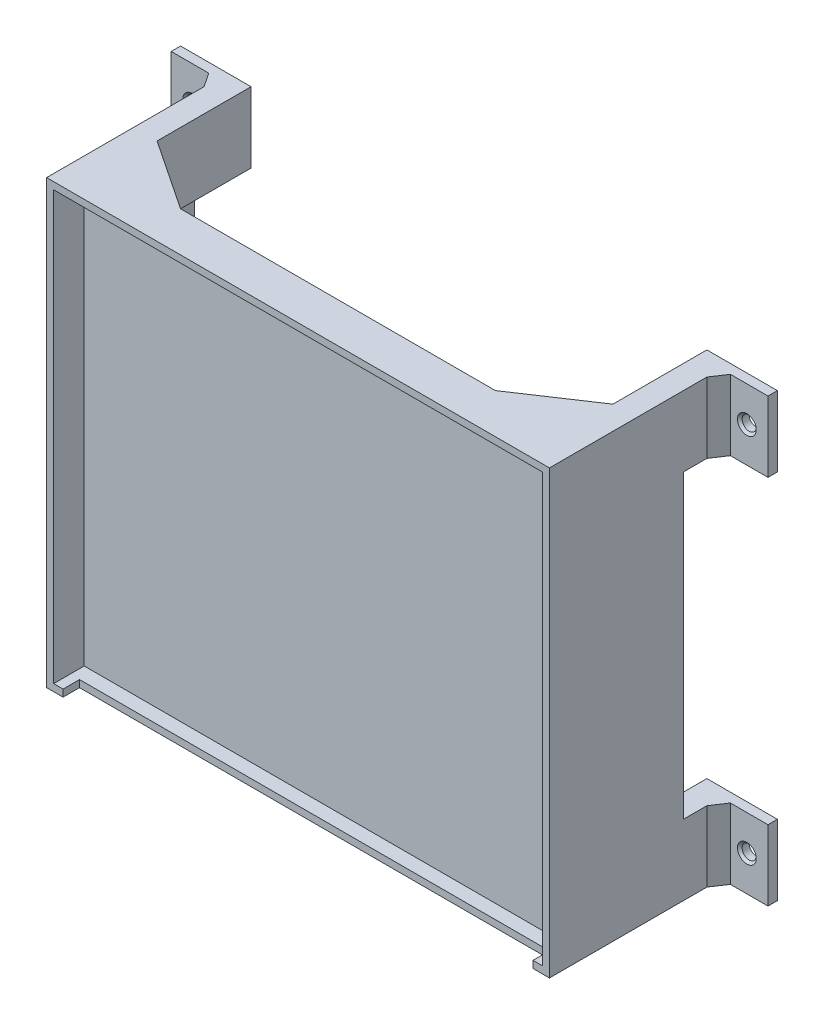
from build123d import *

# Parameters (mm, degrees)
SKETCH_1_W               = 107
SKETCH_1_H               = 94
EXTRUDE_1_DEPTH          = 2
SKETCH_2_W               = 107
SKETCH_2_H               = 94
SKETCH_2_W_2             = 104
SKETCH_2_H_2             = 91
EXTRUDE_2_DEPTH          = 6.5
SKETCH_5_W               = 100
SKETCH_5_H               = 3.5
CUT_EXTRUDE_2_DEPTH      = 1.5
SKETCH_3_W               = 5
SKETCH_3_H               = 15
EXTRUDE_3_DEPTH          = 30
CUT_EXTRUDE_3_DEPTH      = 148.537283424
CUT_EXTRUDE_3_DEPTH_BACK = 30
SKETCH_6_W               = 3
SKETCH_6_H               = 9
SKETCH_7_W               = 10
SKETCH_7_H               = 15
EXTRUDE_4_DEPTH          = 2
SKETCH_8_R               = 1.5
CUT_EXTRUDE_4_DEPTH      = 2
CHAMFER_1_SIZE           = 0.5
EXTRUDE_5_DEPTH          = 3
EXTRUDE_6_DEPTH          = 3
EXTRUDE_7_DEPTH          = 3
MIRROR_2_COPY_1_DEPTH    = 3
EXTRUDE_8_DEPTH          = 15
EXTRUDE_9_DEPTH          = 15
EXTRUDE_10_DEPTH         = 9
EXTRUDE_11_DEPTH         = 9
EXTRUDE_12_DEPTH         = 3


with BuildPart() as part:
    # 草图1 → 凸台-拉伸1 (new body)
    with BuildSketch(Plane.XY):
        with Locations((53.5, -47)):
            Rectangle(SKETCH_1_W, SKETCH_1_H)
    extrude(amount=EXTRUDE_1_DEPTH)

    # 草图2 → 凸台-拉伸2 (add)
    with BuildSketch(Plane.XY.offset(2)):
        with Locations((53.5, -47)):
            Rectangle(SKETCH_2_W, SKETCH_2_H)
        with Locations((53.5, -47)):
            Rectangle(SKETCH_2_W_2, SKETCH_2_H_2, mode=Mode.SUBTRACT)
    extrude(amount=EXTRUDE_2_DEPTH)

    # 草图5 → 切除-拉伸2 (cut)
    with BuildSketch(Plane(origin=(0, -92.5, 0), x_dir=(1, 0, 0), z_dir=(0, 1, 0))):
        with Locations((53.5, -6.75)):
            Rectangle(SKETCH_5_W, SKETCH_5_H)
    extrude(amount=-CUT_EXTRUDE_2_DEPTH, mode=Mode.SUBTRACT)

    # 草图3 → 凸台-拉伸3 (add)
    with BuildSketch(Plane(origin=(0, 0, 0), x_dir=(-1, 0, 0), z_dir=(0, 0, -1))):
        with Locations((-2.5, -7.5)):
            Rectangle(SKETCH_3_W, SKETCH_3_H)
        with Locations((-104.5, -7.5)):
            Rectangle(SKETCH_3_W, SKETCH_3_H)
        with Locations((-2.5, -86.5)):
            Rectangle(SKETCH_3_W, SKETCH_3_H)
        with Locations((-104.5, -86.5)):
            Rectangle(SKETCH_3_W, SKETCH_3_H)
    extrude(amount=EXTRUDE_3_DEPTH)

    # 草图6 → 切除-拉伸3 (cut, two sides: drawn at the far end of the back side and taken through both)
    with BuildSketch(Plane(origin=(0, 0, -30), x_dir=(-1, 0, 0), z_dir=(0, 0, -1)).offset(-CUT_EXTRUDE_3_DEPTH_BACK)):
        with Locations((-103.5, -7.5)):
            Rectangle(SKETCH_6_W, SKETCH_6_H)
        with Locations((-103.5, -86.5)):
            Rectangle(SKETCH_6_W, SKETCH_6_H)
        with Locations((-3.5, -86.5)):
            Rectangle(SKETCH_6_W, SKETCH_6_H)
        with Locations((-3.5, -7.5)):
            Rectangle(SKETCH_6_W, SKETCH_6_H)
    extrude(amount=CUT_EXTRUDE_3_DEPTH + CUT_EXTRUDE_3_DEPTH_BACK, mode=Mode.SUBTRACT)

    # 草图7 → 凸台-拉伸4 (add)
    with BuildSketch(Plane(origin=(0, 0, -30), x_dir=(-1, 0, 0), z_dir=(0, 0, -1))):
        with Locations((5, -7.5)):
            Rectangle(SKETCH_7_W, SKETCH_7_H)
        with Locations((5, -86.5)):
            Rectangle(SKETCH_7_W, SKETCH_7_H)
        with Locations((-112, -7.5)):
            Rectangle(SKETCH_7_W, SKETCH_7_H)
        with Locations((-112, -86.5)):
            Rectangle(SKETCH_7_W, SKETCH_7_H)
    extrude(amount=-EXTRUDE_4_DEPTH)

    # 草图8 → 切除-拉伸4 (cut)
    with BuildSketch(Plane.XY.offset(-28)):
        with Locations((112.5, -7.5)):
            Circle(SKETCH_8_R)
        with Locations(Location((112.5, -86.5, 0), (0, 0, 180))):
            Circle(SKETCH_8_R)
        with Locations(Location((-5.5, -7.5, 0), (0, 0, 180))):
            Circle(SKETCH_8_R)
        with Locations((-5.5, -86.5)):
            Circle(SKETCH_8_R)
    extrude(amount=-CUT_EXTRUDE_4_DEPTH, mode=Mode.SUBTRACT)

    # 倒角1
    chamfer_1_edges = [part.edges().sort_by_distance(p)[0] for p in [
        (114, -86.5, -28),
        (-4, -7.5, -28),
        (-7, -86.5, -28),
        (111, -7.5, -28),
    ]]
    chamfer(chamfer_1_edges, length=CHAMFER_1_SIZE)

    # 草图9 → 凸台-拉伸5 (add)
    with BuildSketch(Plane.XZ.offset(94)):
        Polygon((87, 0), (102, -10), (102, 0), align=None)
        Polygon((5, 0), (20, 0), (5, -10), align=None)
    extrude_5 = extrude(amount=-EXTRUDE_5_DEPTH)

    # 草图10 → 凸台-拉伸6 (add)
    with BuildSketch(Plane(origin=(0, -79, 0), x_dir=(1, 0, 0), z_dir=(0, 1, 0))):
        Polygon((102, 10), (87, 0), (102, 0), align=None)
        Polygon((5, 0), (5, 10), (20, 0), align=None)
    extrude_6 = extrude(amount=-EXTRUDE_6_DEPTH)

    # 草图11 → 凸台-拉伸7 (add)
    with BuildSketch(Plane.ZY):
        Polygon((-20, -79), (0, -69), (0, -79), align=None)
    extrude_7 = extrude(amount=-EXTRUDE_7_DEPTH)

    # 镜向1: 凸台-拉伸7 across plane
    add(extrude_7.mirror(Plane(origin=(53.5, 0, 0), x_dir=(0, 0, 1), z_dir=(1, 0, 0))))

    # 镜向2: 凸台-拉伸5, 凸台-拉伸6, 凸台-拉伸7 across plane
    add(extrude_5.mirror(Plane.ZX.offset(-47)))
    add(extrude_6.mirror(Plane.ZX.offset(-47)))
    add(extrude_7.mirror(Plane.ZX.offset(-47)))

    # 镜向2 copy 1 sketch → 镜向2 copy 1 (add)
    with BuildSketch(Plane(origin=(107, -94, 0), x_dir=(0, 0, 1), z_dir=(1, 0, 0))):
        Polygon((-20, -79), (0, -69), (0, -79), align=None)
    extrude(amount=-MIRROR_2_COPY_1_DEPTH)

    # 草图12 → 凸台-拉伸8 (add)
    with BuildSketch(Plane(origin=(0, 0, 0), x_dir=(1, 0, 0), z_dir=(0, 1, 0))):
        Polygon((107, 25), (109, 28), (107, 28), align=None)
    extrude_8 = extrude(amount=-EXTRUDE_8_DEPTH)

    # 草图13 → 凸台-拉伸9 (add)
    with BuildSketch(Plane.XZ.offset(94)):
        Polygon((109, -28), (107, -25), (107, -28), align=None)
    extrude_9 = extrude(amount=-EXTRUDE_9_DEPTH)

    # 镜向3: 凸台-拉伸8, 凸台-拉伸9 across plane
    add(extrude_8.mirror(Plane(origin=(53.5, 0, 0), x_dir=(0, 0, 1), z_dir=(1, 0, 0))))
    add(extrude_9.mirror(Plane(origin=(53.5, 0, 0), x_dir=(0, 0, 1), z_dir=(1, 0, 0))))

    # 草图14 → 凸台-拉伸10 (add)
    with BuildSketch(Plane(origin=(0, -91, 0), x_dir=(1, 0, 0), z_dir=(0, 1, 0))):
        Polygon((2, 30), (2, 0), (20, 0), (5, 10), (5, 30), align=None)
        Polygon((102, 30), (102, 10), (87, 0), (105, 0), (105, 30), align=None)
    extrude(amount=EXTRUDE_10_DEPTH)

    # 草图15 → 凸台-拉伸11 (add)
    with BuildSketch(Plane.XZ.offset(3)):
        Polygon((105, -30), (105, 0), (87, 0), (102, -10), (102, -30), align=None)
        Polygon((5, -30), (5, -10), (20, 0), (2, 0), (2, -30), align=None)
    extrude(amount=EXTRUDE_11_DEPTH)

    # 草图17 → 凸台-拉伸12 (add)
    with BuildSketch(Plane.ZY):
        Polygon((-20, -15), (-20, -79), (0, -69), (0, -25), align=None)
    extrude_12 = extrude(amount=-EXTRUDE_12_DEPTH)

    # 镜向4: 凸台-拉伸12 across plane
    add(extrude_12.mirror(Plane(origin=(53.5, 0, 0), x_dir=(0, 0, 1), z_dir=(1, 0, 0))))


solid = part.part
